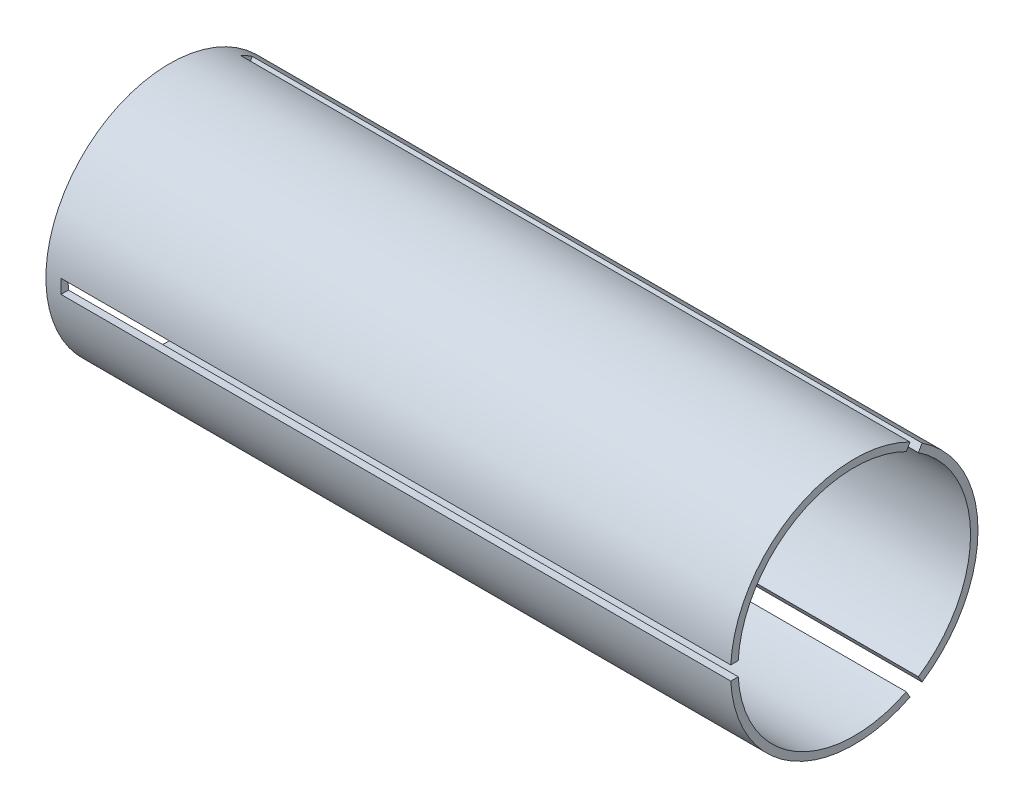
from build123d import *

# Parameters (mm, degrees)
SKETCH1_R           = 42.2275
SKETCH1_R_2         = 39.6875
BOSS_EXTRUDE1_DEPTH = 233.68
SKETCH2_W           = 4.7625
SKETCH2_H           = 228.6
CUT_EXTRUDE1_DEPTH  = 242.190103264
CIRPATTERN1_COUNT   = 3


with BuildPart() as part:
    # Sketch1 → Boss-Extrude1 (new body)
    with BuildSketch(Plane.YZ):
        with Locations(Location((0, 0, 0), (0, 0, 90))):
            Circle(SKETCH1_R)
        with Locations(Location((0, 0, 0), (0, 0, 90))):
            Circle(SKETCH1_R_2, mode=Mode.SUBTRACT)
    extrude(amount=BOSS_EXTRUDE1_DEPTH)

    # Sketch2 → Cut-Extrude1 (cut, through all)
    with BuildSketch(Plane(origin=(0, 0, 0), x_dir=(0, 1, 0), z_dir=(0, 0, 1))):
        with Locations((0, -119.38)):
            Rectangle(SKETCH2_W, SKETCH2_H)
    cut_extrude1 = extrude(amount=CUT_EXTRUDE1_DEPTH, mode=Mode.SUBTRACT)

    # CirPattern1: Cut-Extrude1 ×3 about axis
    cirpattern1_axis = Axis((0, 0, 0), (1, 0, 0))
    for i in range(1, CIRPATTERN1_COUNT):
        add(cut_extrude1.rotate(cirpattern1_axis, i * 360 / CIRPATTERN1_COUNT), mode=Mode.SUBTRACT)


solid = part.part
